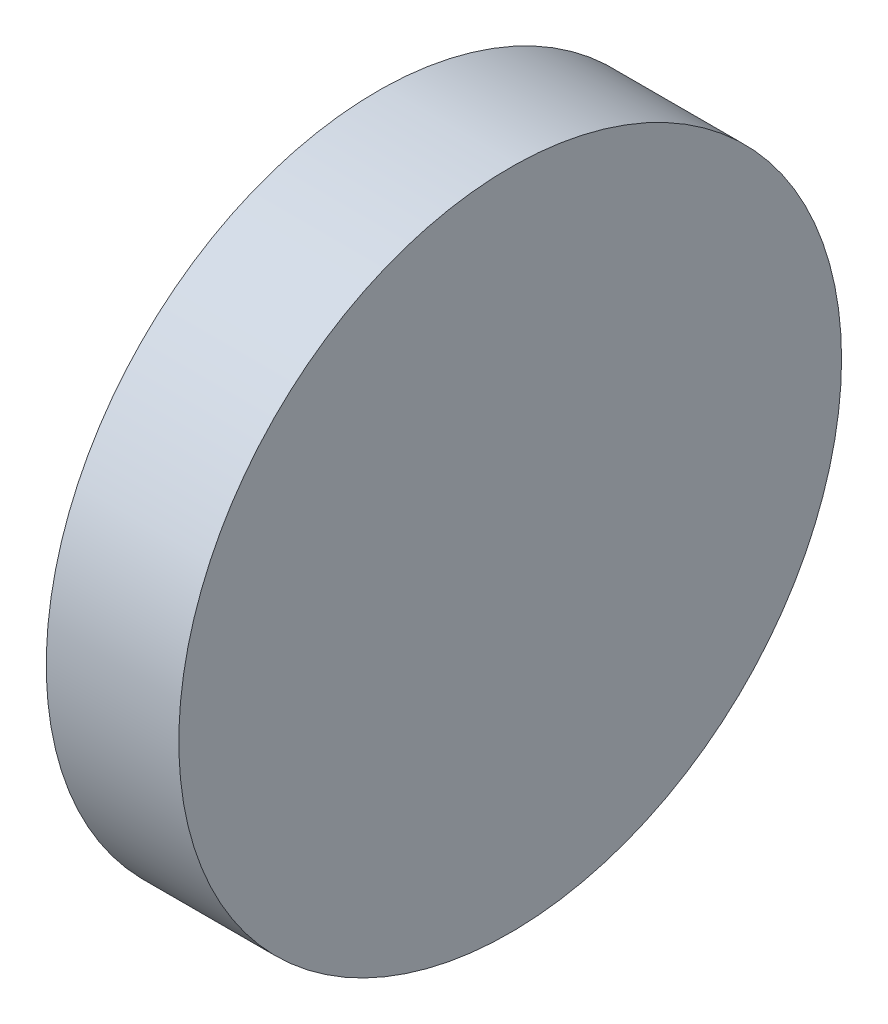
from build123d import *

# Parameters (mm, degrees)
SKETCH1_R           = 2.5
BOSS_EXTRUDE1_DEPTH = 0.5


with BuildPart() as part:
    # Sketch1 → Boss-Extrude1 (new, symmetric)
    with BuildSketch(Plane(origin=(0, 0, 0), x_dir=(0, 0, -1), z_dir=(1, 0, 0))):
        Circle(SKETCH1_R)
    extrude(amount=BOSS_EXTRUDE1_DEPTH, both=True)


solid = part.part
